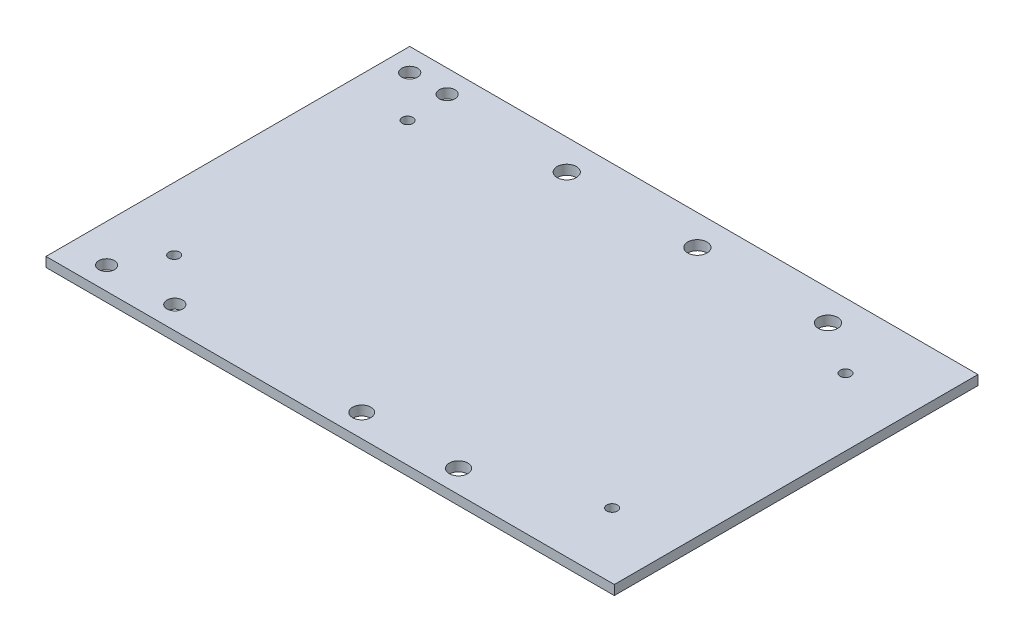
from build123d import *

# Parameters (mm, degrees)
SKETCH1_W           = 375
SKETCH1_H           = 240
SKETCH1_R           = 5.181490122
SKETCH1_R_2         = 6.018247546
SKETCH1_R_3         = 6.106953205
SKETCH1_R_4         = 3.5
SKETCH1_R_5         = 6.35
BOSS_EXTRUDE1_DEPTH = 6.35


with BuildPart() as part:
    # Sketch1 → Boss-Extrude1 (new body)
    with BuildSketch(Plane(origin=(0, 0, 0), x_dir=(1, 0, 0), z_dir=(0, 1, 0))):
        with Locations((187.5, -120)):
            Rectangle(SKETCH1_W, SKETCH1_H)
        with Locations(Location((15, -15, 0), (0, 0, 270))):
            Circle(SKETCH1_R, mode=Mode.SUBTRACT)
        with Locations(Location((39.680379951, -15, 0), (0, 0, 270))):
            Circle(SKETCH1_R, mode=Mode.SUBTRACT)
        with Locations(Location((25, -225, 0), (0, 0, 270))):
            Circle(SKETCH1_R, mode=Mode.SUBTRACT)
        with Locations(Location((70, -225, 0), (0, 0, 270))):
            Circle(SKETCH1_R, mode=Mode.SUBTRACT)
        with Locations(Location((193.34, -225, 0), (0, 0, 270))):
            Circle(SKETCH1_R_2, mode=Mode.SUBTRACT)
        with Locations(Location((257.244291662, -225, 0), (0, 0, 270))):
            Circle(SKETCH1_R_3, mode=Mode.SUBTRACT)
        with Locations(Location((41.566569972, -43, 0), (0, 0, 270))):
            Circle(SKETCH1_R_4, mode=Mode.SUBTRACT)
        with Locations(Location((41.566569972, -197, 0), (0, 0, 270))):
            Circle(SKETCH1_R_4, mode=Mode.SUBTRACT)
        with Locations(Location((330.566569972, -197, 0), (0, 0, 270))):
            Circle(SKETCH1_R_4, mode=Mode.SUBTRACT)
        with Locations(Location((330.566569972, -43, 0), (0, 0, 270))):
            Circle(SKETCH1_R_4, mode=Mode.SUBTRACT)
        with Locations(Location((209.82, -20, 0), (0, 0, 270))):
            Circle(SKETCH1_R_5, mode=Mode.SUBTRACT)
        with Locations(Location((123.622084245, -20, 0), (0, 0, 270))):
            Circle(SKETCH1_R_5, mode=Mode.SUBTRACT)
        with Locations(Location((296.017915755, -20, 0), (0, 0, 270))):
            Circle(SKETCH1_R_5, mode=Mode.SUBTRACT)
    extrude(amount=-BOSS_EXTRUDE1_DEPTH)


solid = part.part
